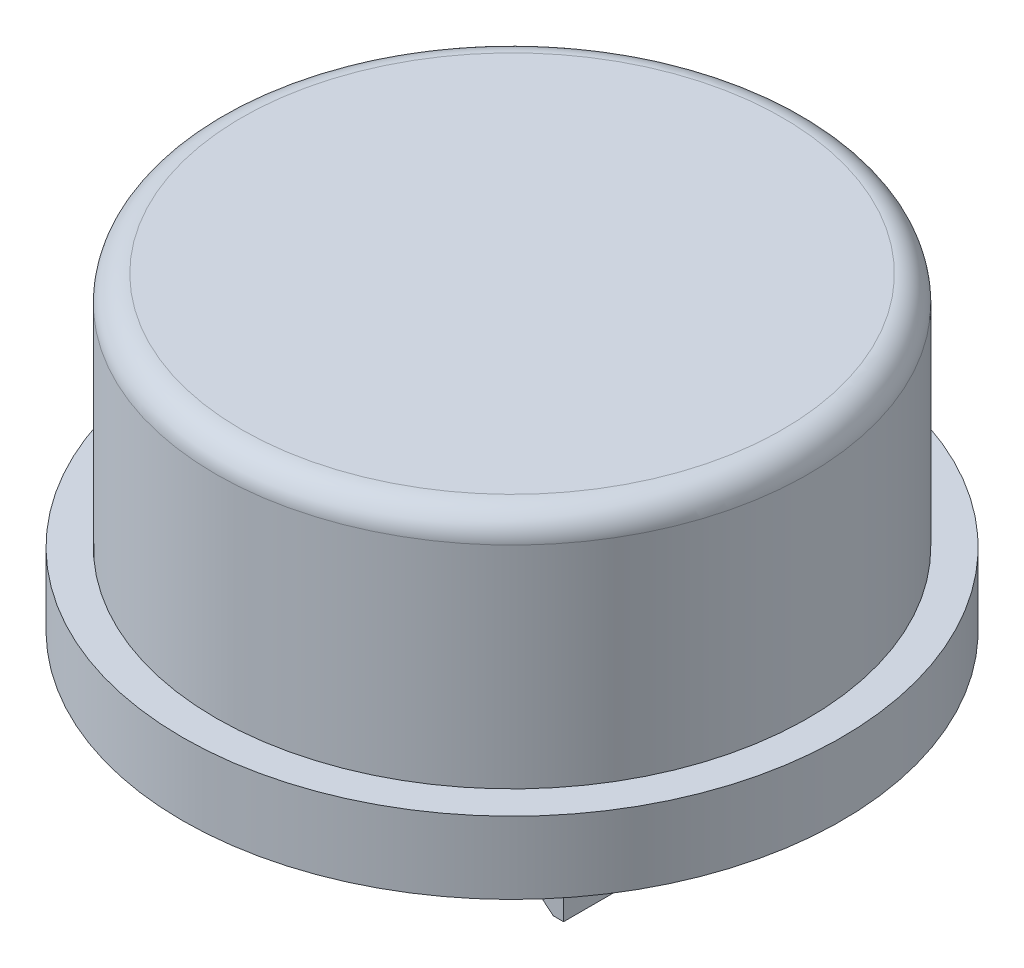
from build123d import *

# Parameters (mm, degrees)
SKETCH1_R           = 5.75
BOSS_EXTRUDE1_DEPTH = 6
SKETCH2_R           = 6.4
BOSS_EXTRUDE2_DEPTH = 1.4
SKETCH3_R           = 4.9
CUT_EXTRUDE1_DEPTH  = 5
SKETCH4_W           = 0.8
SKETCH4_H           = 6.5
BOSS_EXTRUDE3_DEPTH = 1
BOSS_EXTRUDE4_DEPTH = 1.9
BOSS_EXTRUDE5_START = 4.5
BOSS_EXTRUDE5_DEPTH = 4.5
FILLET1_R           = 0.5


with BuildPart() as part:
    # Sketch1 → Boss-Extrude1 (new body)
    with BuildSketch(Plane(origin=(0, 0, 0), x_dir=(1, 0, 0), z_dir=(0, 1, 0))):
        with Locations(Location((0, 0, 0), (0, 0, 270))):
            Circle(SKETCH1_R)
    extrude(amount=BOSS_EXTRUDE1_DEPTH)

    # Sketch2 → Boss-Extrude2 (add)
    with BuildSketch(Plane(origin=(0, 0, 0), x_dir=(1, 0, 0), z_dir=(0, 1, 0))):
        with Locations(Location((0, 0, 0), (0, 0, 270))):
            Circle(SKETCH2_R)
    extrude(amount=BOSS_EXTRUDE2_DEPTH)

    # Sketch3 → Cut-Extrude1 (cut)
    with BuildSketch(Plane(origin=(0, 0, 0), x_dir=(1, 0, 0), z_dir=(0, 1, 0))):
        with Locations(Location((0, 0, 0), (0, 0, 270))):
            Circle(SKETCH3_R)
    extrude(amount=CUT_EXTRUDE1_DEPTH, mode=Mode.SUBTRACT)

    # Sketch4 → Boss-Extrude3 (add, symmetric)
    with BuildSketch(Plane(origin=(0, 0, 0), x_dir=(0, 0, -1), z_dir=(1, 0, 0))):
        with Locations((2.4, 1.75)):
            Rectangle(SKETCH4_W, SKETCH4_H)
        with Locations((-2.4, 1.75)):
            Rectangle(SKETCH4_W, SKETCH4_H)
    extrude(amount=BOSS_EXTRUDE3_DEPTH, both=True)

    # Sketch5 → Boss-Extrude4 (add, symmetric)
    with BuildSketch(Plane.XY):
        with BuildLine():
            Line((2.9, 5), (2, 5))
            Line((2, 5), (2, -0.9))
            Line((2, -0.9), (1.8, -1.4))
            ThreePointArc((1.8, -1.4), (2.183918232, -2.004066901), (2.7, -2.5))
            Line((2.7, -2.5), (2.9, -2.5))
            Line((2.9, -2.5), (2.9, 5))
        make_face()
        with BuildLine():
            Line((-1.8, -1.4), (-2, -0.9))
            Line((-2, -0.9), (-2, 5))
            Line((-2, 5), (-2.9, 5))
            Line((-2.9, 5), (-2.9, -2.5))
            Line((-2.9, -2.5), (-2.7, -2.5))
            ThreePointArc((-2.7, -2.5), (-2.183918232, -2.004066901), (-1.8, -1.4))
        make_face()
    extrude(amount=BOSS_EXTRUDE4_DEPTH, both=True)

    # Sketch6 → Boss-Extrude5 (add)
    with BuildSketch(Plane.XZ.offset(-5).offset(BOSS_EXTRUDE5_START)):
        with BuildLine():
            Line((-2.9, 0.35), (-4.887484015, 0.35))
            ThreePointArc((-4.887484015, 0.35), (-4.9, 0), (-4.887484015, -0.35))
            Line((-4.887484015, -0.35), (-2.9, -0.35))
            Line((-2.9, -0.35), (-2.9, 0.35))
        make_face()
        with BuildLine():
            Line((0.35, 2.8), (0.35, 4.887484015))
            ThreePointArc((0.35, 4.887484015), (0, 4.9), (-0.35, 4.887484015))
            Line((-0.35, 4.887484015), (-0.35, 2.8))
            Line((-0.35, 2.8), (0.35, 2.8))
        make_face()
        with BuildLine():
            Line((2.9, -0.35), (4.887484015, -0.35))
            ThreePointArc((4.887484015, -0.35), (4.9, 0), (4.887484015, 0.35))
            Line((4.887484015, 0.35), (2.9, 0.35))
            Line((2.9, 0.35), (2.9, -0.35))
        make_face()
        with BuildLine():
            Line((-0.35, -2.8), (-0.35, -4.887484015))
            ThreePointArc((-0.35, -4.887484015), (0, -4.9), (0.35, -4.887484015))
            Line((0.35, -4.887484015), (0.35, -2.8))
            Line((0.35, -2.8), (-0.35, -2.8))
        make_face()
    extrude(amount=-BOSS_EXTRUDE5_DEPTH)

    # Fillet1
    fillet1_edges = [part.edges().sort_by_distance(p)[0] for p in [
        (0, 6, -5.75),
    ]]
    fillet(fillet1_edges, radius=FILLET1_R)


solid = part.part
